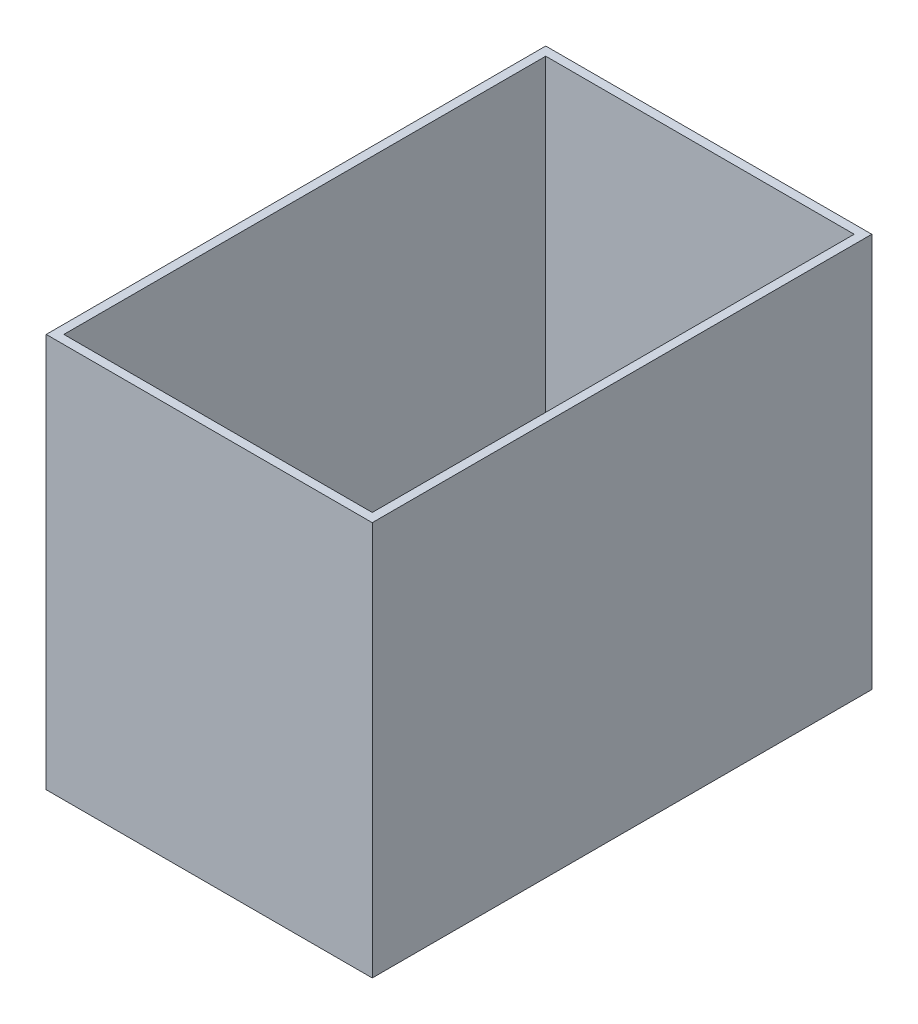
from build123d import *

# Parameters (mm, degrees)
SKETCH1_W           = 111
SKETCH1_H           = 170.0625
BOSS_EXTRUDE1_DEPTH = 3
SKETCH2_W           = 111
SKETCH2_H           = 170.0625
SKETCH2_W_2         = 105
SKETCH2_H_2         = 164.0625
BOSS_EXTRUDE2_DEPTH = 131.25
SKETCH3_R           = 47
CUT_EXTRUDE1_DEPTH  = 3


with BuildPart() as part:
    # Sketch1 → Boss-Extrude1 (new body)
    with BuildSketch(Plane(origin=(0, 0, 0), x_dir=(1, 0, 0), z_dir=(0, 1, 0))):
        with Locations((55.5, -85.03125)):
            Rectangle(SKETCH1_W, SKETCH1_H)
    extrude(amount=BOSS_EXTRUDE1_DEPTH)

    # Sketch2 → Boss-Extrude2 (add)
    with BuildSketch(Plane(origin=(0, 3, 0), x_dir=(1, 0, 0), z_dir=(0, 1, 0))):
        with Locations((55.5, -85.03125)):
            Rectangle(SKETCH2_W, SKETCH2_H)
        with Locations((55.5, -85.03125)):
            Rectangle(SKETCH2_W_2, SKETCH2_H_2, mode=Mode.SUBTRACT)
    extrude(amount=BOSS_EXTRUDE2_DEPTH)

    # Sketch3 → Cut-Extrude1 (cut)
    with BuildSketch(Plane(origin=(0, 0, 0), x_dir=(-1, 0, 0), z_dir=(0, -1, 0))):
        with Locations(Location((-55.5, -85.03125, 0), (0, 0, 90))):
            Circle(SKETCH3_R)
    extrude(amount=-CUT_EXTRUDE1_DEPTH, mode=Mode.SUBTRACT)


solid = part.part
